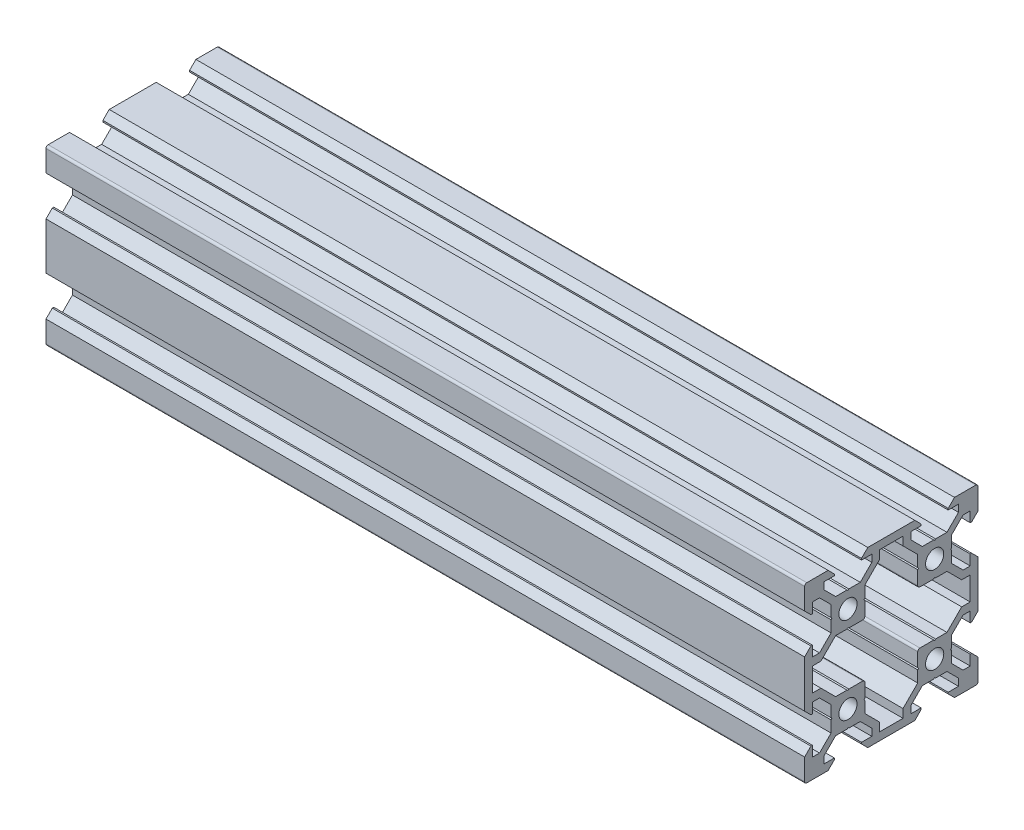
from build123d import *

# Parameters (mm, degrees)
PROFILE_SKETCH_R      = 2.1
PROFILE_EXTRUDE_DEPTH = 175


with BuildPart() as part:
    # Profile Sketch → Profile Extrude (new body)
    with BuildSketch(Plane(origin=(0, 0, 0), x_dir=(0, 0, -1), z_dir=(1, 0, 0))):
        with BuildLine():
            Line((5.42, 10), (0, 10))
            Line((0, 10), (-5.42, 10))
            Line((-5.42, 10), (-6.875, 8.545))
            Line((-6.875, 8.545), (-6.875, 8.2))
            Line((-6.875, 8.2), (-4.5, 8.2))
            Line((-4.5, 8.2), (-4.5, 6.56))
            Line((-4.5, 6.56), (-7.16, 3.9))
            Line((-7.16, 3.9), (-9.79, 3.9))
            Line((-9.79, 3.9), (-10, 3.69))
            Line((-10, 3.69), (-10.21, 3.9))
            Line((-10.21, 3.9), (-12.84, 3.9))
            Line((-12.84, 3.9), (-15.5, 6.56))
            Line((-15.5, 6.56), (-15.5, 8.2))
            Line((-15.5, 8.2), (-13.125, 8.2))
            Line((-13.125, 8.2), (-13.125, 8.545))
            Line((-13.125, 8.545), (-14.58, 10))
            Line((-14.58, 10), (-19.5, 10))
            ThreePointArc((-19.5, 10), (-19.853553391, 9.853553391), (-20, 9.5))
            Line((-20, 9.5), (-20, 4.58))
            Line((-20, 4.58), (-18.545, 3.125))
            Line((-18.545, 3.125), (-18.2, 3.125))
            Line((-18.2, 3.125), (-18.2, 5.5))
            Line((-18.2, 5.5), (-16.56, 5.5))
            Line((-16.56, 5.5), (-13.9, 2.838679656))
            Line((-13.9, 2.838679656), (-13.9, 0.21))
            Line((-13.9, 0.21), (-13.69, 0))
            Line((-13.69, 0), (-13.9, -0.21))
            Line((-13.9, -0.21), (-13.9, -2.838679656))
            Line((-13.9, -2.838679656), (-16.56, -5.5))
            Line((-16.56, -5.5), (-18.2, -5.5))
            Line((-18.2, -5.5), (-18.2, -3.125))
            Line((-18.2, -3.125), (-18.545, -3.125))
            Line((-18.545, -3.125), (-20, -4.58))
            Line((-20, -4.58), (-20, -15.42))
            Line((-20, -15.42), (-18.545, -16.875))
            Line((-18.545, -16.875), (-18.2, -16.875))
            Line((-18.2, -16.875), (-18.2, -14.5))
            Line((-18.2, -14.5), (-16.56, -14.5))
            Line((-16.56, -14.5), (-13.9, -17.161320344))
            Line((-13.9, -17.161320344), (-13.9, -19.79))
            Line((-13.9, -19.79), (-13.69, -20))
            Line((-13.69, -20), (-13.9, -20.21))
            Line((-13.9, -20.21), (-13.9, -22.838679656))
            Line((-13.9, -22.838679656), (-16.56, -25.5))
            Line((-16.56, -25.5), (-18.2, -25.5))
            Line((-18.2, -25.5), (-18.2, -23.125))
            Line((-18.2, -23.125), (-18.545, -23.125))
            Line((-18.545, -23.125), (-20, -24.58))
            Line((-20, -24.58), (-20, -29.5))
            ThreePointArc((-20, -29.5), (-19.853553391, -29.853553391), (-19.5, -30))
            Line((-19.5, -30), (-14.58, -30))
            Line((-14.58, -30), (-13.125, -28.545))
            Line((-13.125, -28.545), (-13.125, -28.2))
            Line((-13.125, -28.2), (-15.5, -28.2))
            Line((-15.5, -28.2), (-15.5, -26.56))
            Line((-15.5, -26.56), (-12.84, -23.9))
            Line((-12.84, -23.9), (-10.21, -23.9))
            Line((-10.21, -23.9), (-10, -23.69))
            Line((-10, -23.69), (-9.79, -23.9))
            Line((-9.79, -23.9), (-7.16, -23.9))
            Line((-7.16, -23.9), (-4.5, -26.56))
            Line((-4.5, -26.56), (-4.5, -28.2))
            Line((-4.5, -28.2), (-6.875, -28.2))
            Line((-6.875, -28.2), (-6.875, -28.545))
            Line((-6.875, -28.545), (-5.42, -30))
            Line((-5.42, -30), (0, -30))
            Line((0, -30), (5.42, -30))
            Line((5.42, -30), (6.875, -28.545))
            Line((6.875, -28.545), (6.875, -28.2))
            Line((6.875, -28.2), (4.5, -28.2))
            Line((4.5, -28.2), (4.5, -26.56))
            Line((4.5, -26.56), (7.16, -23.9))
            Line((7.16, -23.9), (9.79, -23.9))
            Line((9.79, -23.9), (10, -23.69))
            Line((10, -23.69), (10.21, -23.9))
            Line((10.21, -23.9), (12.84, -23.9))
            Line((12.84, -23.9), (15.5, -26.56))
            Line((15.5, -26.56), (15.5, -28.2))
            Line((15.5, -28.2), (13.125, -28.2))
            Line((13.125, -28.2), (13.125, -28.545))
            Line((13.125, -28.545), (14.58, -30))
            Line((14.58, -30), (19.5, -30))
            ThreePointArc((19.5, -30), (19.853553391, -29.853553391), (20, -29.5))
            Line((20, -29.5), (20, -24.58))
            Line((20, -24.58), (18.545, -23.125))
            Line((18.545, -23.125), (18.2, -23.125))
            Line((18.2, -23.125), (18.2, -25.5))
            Line((18.2, -25.5), (16.56, -25.5))
            Line((16.56, -25.5), (13.9, -22.838679656))
            Line((13.9, -22.838679656), (13.9, -20.21))
            Line((13.9, -20.21), (13.69, -20))
            Line((13.69, -20), (13.9, -19.79))
            Line((13.9, -19.79), (13.9, -17.161320344))
            Line((13.9, -17.161320344), (16.56, -14.5))
            Line((16.56, -14.5), (18.2, -14.5))
            Line((18.2, -14.5), (18.2, -16.875))
            Line((18.2, -16.875), (18.545, -16.875))
            Line((18.545, -16.875), (20, -15.42))
            Line((20, -15.42), (20, -4.58))
            Line((20, -4.58), (18.545, -3.125))
            Line((18.545, -3.125), (18.2, -3.125))
            Line((18.2, -3.125), (18.2, -5.5))
            Line((18.2, -5.5), (16.56, -5.5))
            Line((16.56, -5.5), (13.9, -2.838679656))
            Line((13.9, -2.838679656), (13.9, -0.21))
            Line((13.9, -0.21), (13.69, 0))
            Line((13.69, 0), (13.9, 0.21))
            Line((13.9, 0.21), (13.9, 2.838679656))
            Line((13.9, 2.838679656), (16.56, 5.5))
            Line((16.56, 5.5), (18.2, 5.5))
            Line((18.2, 5.5), (18.2, 3.125))
            Line((18.2, 3.125), (18.545, 3.125))
            Line((18.545, 3.125), (20, 4.58))
            Line((20, 4.58), (20, 9.5))
            ThreePointArc((20, 9.5), (19.853553391, 9.853553391), (19.5, 10))
            Line((19.5, 10), (14.58, 10))
            Line((14.58, 10), (13.125, 8.545))
            Line((13.125, 8.545), (13.125, 8.2))
            Line((13.125, 8.2), (15.5, 8.2))
            Line((15.5, 8.2), (15.5, 6.56))
            Line((15.5, 6.56), (12.84, 3.9))
            Line((12.84, 3.9), (10.21, 3.9))
            Line((10.21, 3.9), (10, 3.69))
            Line((10, 3.69), (9.79, 3.9))
            Line((9.79, 3.9), (7.16, 3.9))
            Line((7.16, 3.9), (4.5, 6.56))
            Line((4.5, 6.56), (4.5, 8.2))
            Line((4.5, 8.2), (6.875, 8.2))
            Line((6.875, 8.2), (6.875, 8.545))
            Line((6.875, 8.545), (5.42, 10))
        make_face()
        with Locations((-10, -20)):
            Circle(PROFILE_SKETCH_R, mode=Mode.SUBTRACT)
        with Locations((10, -20)):
            Circle(PROFILE_SKETCH_R, mode=Mode.SUBTRACT)
        with Locations((-10, 0)):
            Circle(PROFILE_SKETCH_R, mode=Mode.SUBTRACT)
        with BuildLine():
            Line((-2.7, 8.2), (2.7, 8.2))
            Line((2.7, 8.2), (2.7, 6.238679656))
            Line((2.7, 6.238679656), (6.1, 2.838679656))
            Line((6.1, 2.838679656), (6.1, 0.21))
            Line((6.1, 0.21), (6.31, 0))
            Line((6.31, 0), (6.1, -0.21))
            Line((6.1, -0.21), (6.1, -3.4))
            ThreePointArc((6.1, -3.4), (6.246446609, -3.753553391), (6.6, -3.9))
            Line((6.6, -3.9), (9.79, -3.9))
            Line((9.79, -3.9), (10, -3.69))
            Line((10, -3.69), (10.21, -3.9))
            Line((10.21, -3.9), (12.84, -3.9))
            Line((12.84, -3.9), (16.23831318, -7.3))
            Line((16.23831318, -7.3), (18.2, -7.3))
            Line((18.2, -7.3), (18.2, -12.7))
            Line((18.2, -12.7), (16.23831318, -12.7))
            Line((16.23831318, -12.7), (12.84, -16.1))
            Line((12.84, -16.1), (10.21, -16.1))
            Line((10.21, -16.1), (10, -16.31))
            Line((10, -16.31), (9.79, -16.1))
            Line((9.79, -16.1), (6.6, -16.1))
            ThreePointArc((6.6, -16.1), (6.246446609, -16.246446609), (6.1, -16.6))
            Line((6.1, -16.6), (6.1, -19.79))
            Line((6.1, -19.79), (6.31, -20))
            Line((6.31, -20), (6.1, -20.21))
            Line((6.1, -20.21), (6.1, -22.838679656))
            Line((6.1, -22.838679656), (2.7, -26.238679656))
            Line((2.7, -26.238679656), (2.7, -28.2))
            Line((2.7, -28.2), (-2.7, -28.2))
            Line((-2.7, -28.2), (-2.7, -26.238679656))
            Line((-2.7, -26.238679656), (-6.1, -22.838679656))
            Line((-6.1, -22.838679656), (-6.1, -20.21))
            Line((-6.1, -20.21), (-6.31, -20))
            Line((-6.31, -20), (-6.1, -19.79))
            Line((-6.1, -19.79), (-6.1, -16.6))
            ThreePointArc((-6.1, -16.6), (-6.246446609, -16.246446609), (-6.6, -16.1))
            Line((-6.6, -16.1), (-9.79, -16.1))
            Line((-9.79, -16.1), (-10, -16.31))
            Line((-10, -16.31), (-10.21, -16.1))
            Line((-10.21, -16.1), (-12.84, -16.1))
            Line((-12.84, -16.1), (-16.23831318, -12.7))
            Line((-16.23831318, -12.7), (-18.2, -12.7))
            Line((-18.2, -12.7), (-18.2, -7.3))
            Line((-18.2, -7.3), (-16.23831318, -7.3))
            Line((-16.23831318, -7.3), (-12.84, -3.9))
            Line((-12.84, -3.9), (-10.21, -3.9))
            Line((-10.21, -3.9), (-10, -3.69))
            Line((-10, -3.69), (-9.79, -3.9))
            Line((-9.79, -3.9), (-6.6, -3.9))
            ThreePointArc((-6.6, -3.9), (-6.246446609, -3.753553391), (-6.1, -3.4))
            Line((-6.1, -3.4), (-6.1, -0.21))
            Line((-6.1, -0.21), (-6.31, 0))
            Line((-6.31, 0), (-6.1, 0.21))
            Line((-6.1, 0.21), (-6.1, 2.838679656))
            Line((-6.1, 2.838679656), (-2.7, 6.238679656))
            Line((-2.7, 6.238679656), (-2.7, 8.2))
        make_face(mode=Mode.SUBTRACT)
        with Locations((10, 0)):
            Circle(PROFILE_SKETCH_R, mode=Mode.SUBTRACT)
    extrude(amount=PROFILE_EXTRUDE_DEPTH)


solid = part.part
